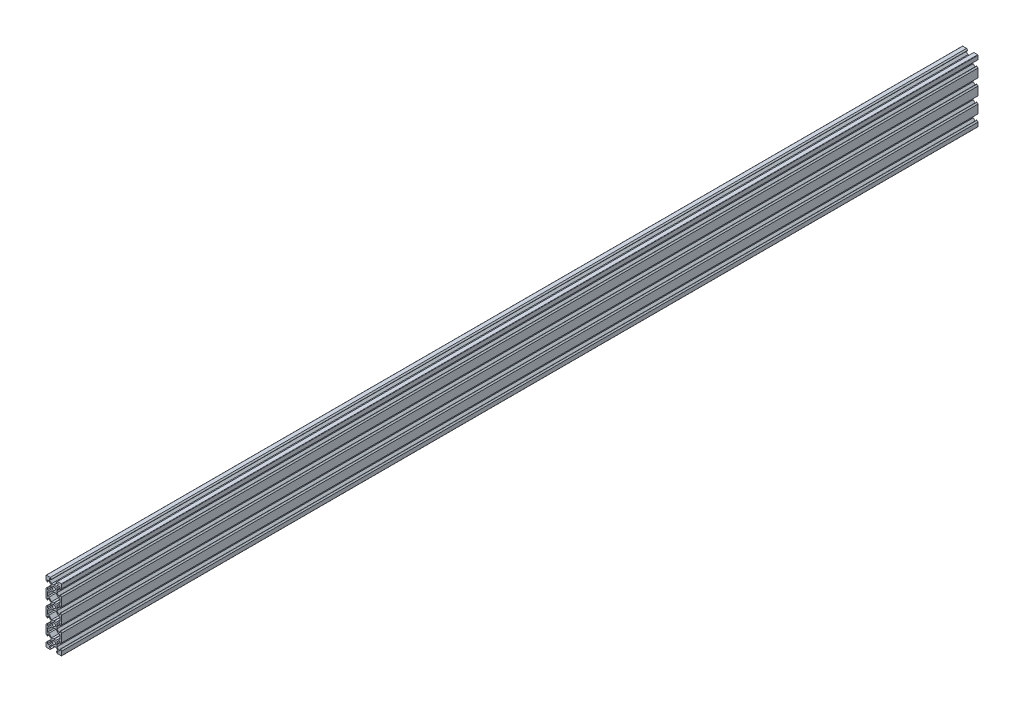
from build123d import *

# Parameters (mm, degrees)
BOSS_EXTRU_1_DEPTH = 1173.42


with BuildPart() as part:
    # Esquisse1 → Boss.-Extru.1 (new body)
    with BuildSketch(Plane.XY):
        with BuildLine():
            Line((-9.5, 10), (-4.58, 10))
            Line((-4.58, 10), (-3.125, 8.545))
            Line((-3.125, 8.545), (-3.125, 8.2))
            Line((-3.125, 8.2), (-5.5, 8.2))
            Line((-5.5, 8.2), (-5.5, 6.560660172))
            Line((-5.5, 6.560660172), (-2.839339828, 3.9))
            Line((-2.839339828, 3.9), (-0.21, 3.9))
            Line((-0.21, 3.9), (0, 3.69))
            Line((0, 3.69), (0, 2.1))
            ThreePointArc((0, 2.1), (-2.1, 0), (0, -2.1))
            Line((0, -2.1), (0, -3.69))
            Line((0, -3.69), (-0.21, -3.9))
            Line((-0.21, -3.9), (-2.839339828, -3.9))
            Line((-2.839339828, -3.9), (-6.239339828, -7.3))
            Line((-6.239339828, -7.3), (-8.2, -7.3))
            Line((-8.2, -7.3), (-8.2, -12.7))
            Line((-8.2, -12.7), (-6.239339828, -12.7))
            Line((-6.239339828, -12.7), (-2.839339828, -16.1))
            Line((-2.839339828, -16.1), (-0.21, -16.1))
            Line((-0.21, -16.1), (0, -16.31))
            Line((0, -16.31), (0, -17.9))
            ThreePointArc((0, -17.9), (-2.1, -20), (0, -22.1))
            Line((0, -22.1), (0, -23.69))
            Line((0, -23.69), (-0.21, -23.9))
            Line((-0.21, -23.9), (-2.839339828, -23.9))
            Line((-2.839339828, -23.9), (-6.239339828, -27.3))
            Line((-6.239339828, -27.3), (-8.2, -27.3))
            Line((-8.2, -27.3), (-8.2, -32.7))
            Line((-8.2, -32.7), (-6.239339828, -32.7))
            Line((-6.239339828, -32.7), (-2.839339828, -36.1))
            Line((-2.839339828, -36.1), (-0.21, -36.1))
            Line((-0.21, -36.1), (0, -36.31))
            Line((0, -36.31), (0, -37.9))
            ThreePointArc((0, -37.9), (-2.1, -40), (0, -42.1))
            Line((0, -42.1), (0, -43.69))
            Line((0, -43.69), (-0.21, -43.9))
            Line((-0.21, -43.9), (-2.839339828, -43.9))
            Line((-2.839339828, -43.9), (-6.239339828, -47.3))
            Line((-6.239339828, -47.3), (-8.2, -47.3))
            Line((-8.2, -47.3), (-8.2, -52.7))
            Line((-8.2, -52.7), (-6.239339828, -52.7))
            Line((-6.239339828, -52.7), (-2.839339828, -56.1))
            Line((-2.839339828, -56.1), (-0.21, -56.1))
            Line((-0.21, -56.1), (0, -56.31))
            Line((0, -56.31), (0, -57.9))
            ThreePointArc((0, -57.9), (-2.1, -60), (0, -62.1))
            Line((0, -62.1), (0, -63.69))
            Line((0, -63.69), (-0.21, -63.9))
            Line((-0.21, -63.9), (-2.839339828, -63.9))
            Line((-2.839339828, -63.9), (-5.5, -66.560660172))
            Line((-5.5, -66.560660172), (-5.5, -68.2))
            Line((-5.5, -68.2), (-3.125, -68.2))
            Line((-3.125, -68.2), (-3.125, -68.545))
            Line((-3.125, -68.545), (-4.58, -70))
            Line((-4.58, -70), (-9.5, -70))
            ThreePointArc((-9.5, -70), (-9.853553391, -69.853553391), (-10, -69.5))
            Line((-10, -69.5), (-10, -64.58))
            Line((-10, -64.58), (-8.545, -63.125))
            Line((-8.545, -63.125), (-8.2, -63.125))
            Line((-8.2, -63.125), (-8.2, -65.5))
            Line((-8.2, -65.5), (-6.560660172, -65.5))
            Line((-6.560660172, -65.5), (-3.9, -62.839339828))
            Line((-3.9, -62.839339828), (-3.9, -60.21))
            Line((-3.9, -60.21), (-3.69, -60))
            Line((-3.69, -60), (-3.9, -59.79))
            Line((-3.9, -59.79), (-3.9, -57.160660172))
            Line((-3.9, -57.160660172), (-6.560660172, -54.5))
            Line((-6.560660172, -54.5), (-8.2, -54.5))
            Line((-8.2, -54.5), (-8.2, -56.875))
            Line((-8.2, -56.875), (-8.545, -56.875))
            Line((-8.545, -56.875), (-10, -55.42))
            Line((-10, -55.42), (-10, -44.58))
            Line((-10, -44.58), (-8.545, -43.125))
            Line((-8.545, -43.125), (-8.2, -43.125))
            Line((-8.2, -43.125), (-8.2, -45.5))
            Line((-8.2, -45.5), (-6.560660172, -45.5))
            Line((-6.560660172, -45.5), (-3.9, -42.839339828))
            Line((-3.9, -42.839339828), (-3.9, -40.21))
            Line((-3.9, -40.21), (-3.69, -40))
            Line((-3.69, -40), (-3.9, -39.79))
            Line((-3.9, -39.79), (-3.9, -37.160660172))
            Line((-3.9, -37.160660172), (-6.560660172, -34.5))
            Line((-6.560660172, -34.5), (-8.2, -34.5))
            Line((-8.2, -34.5), (-8.2, -36.875))
            Line((-8.2, -36.875), (-8.545, -36.875))
            Line((-8.545, -36.875), (-10, -35.42))
            Line((-10, -35.42), (-10, -24.58))
            Line((-10, -24.58), (-8.545, -23.125))
            Line((-8.545, -23.125), (-8.2, -23.125))
            Line((-8.2, -23.125), (-8.2, -25.5))
            Line((-8.2, -25.5), (-6.560660172, -25.5))
            Line((-6.560660172, -25.5), (-3.9, -22.839339828))
            Line((-3.9, -22.839339828), (-3.9, -20.21))
            Line((-3.9, -20.21), (-3.69, -20))
            Line((-3.69, -20), (-3.9, -19.79))
            Line((-3.9, -19.79), (-3.9, -17.160660172))
            Line((-3.9, -17.160660172), (-6.560660172, -14.5))
            Line((-6.560660172, -14.5), (-8.2, -14.5))
            Line((-8.2, -14.5), (-8.2, -16.875))
            Line((-8.2, -16.875), (-8.545, -16.875))
            Line((-8.545, -16.875), (-10, -15.42))
            Line((-10, -15.42), (-10, -4.58))
            Line((-10, -4.58), (-8.545, -3.125))
            Line((-8.545, -3.125), (-8.2, -3.125))
            Line((-8.2, -3.125), (-8.2, -5.5))
            Line((-8.2, -5.5), (-6.560660172, -5.5))
            Line((-6.560660172, -5.5), (-3.9, -2.839339828))
            Line((-3.9, -2.839339828), (-3.9, -0.21))
            Line((-3.9, -0.21), (-3.69, 0))
            Line((-3.69, 0), (-3.9, 0.21))
            Line((-3.9, 0.21), (-3.9, 2.839339828))
            Line((-3.9, 2.839339828), (-6.560660172, 5.5))
            Line((-6.560660172, 5.5), (-8.2, 5.5))
            Line((-8.2, 5.5), (-8.2, 3.125))
            Line((-8.2, 3.125), (-8.545, 3.125))
            Line((-8.545, 3.125), (-10, 4.58))
            Line((-10, 4.58), (-10, 9.5))
            ThreePointArc((-10, 9.5), (-9.853553391, 9.853553391), (-9.5, 10))
        make_face()
    boss_extru_1 = extrude(amount=BOSS_EXTRU_1_DEPTH)

    # Symétrie1: Boss.-Extru.1 across plane
    add(boss_extru_1.mirror(Plane(origin=(0, 3.69, 1173.42), x_dir=(0, 0, 1), z_dir=(-1, 0, 0))))


solid = part.part
